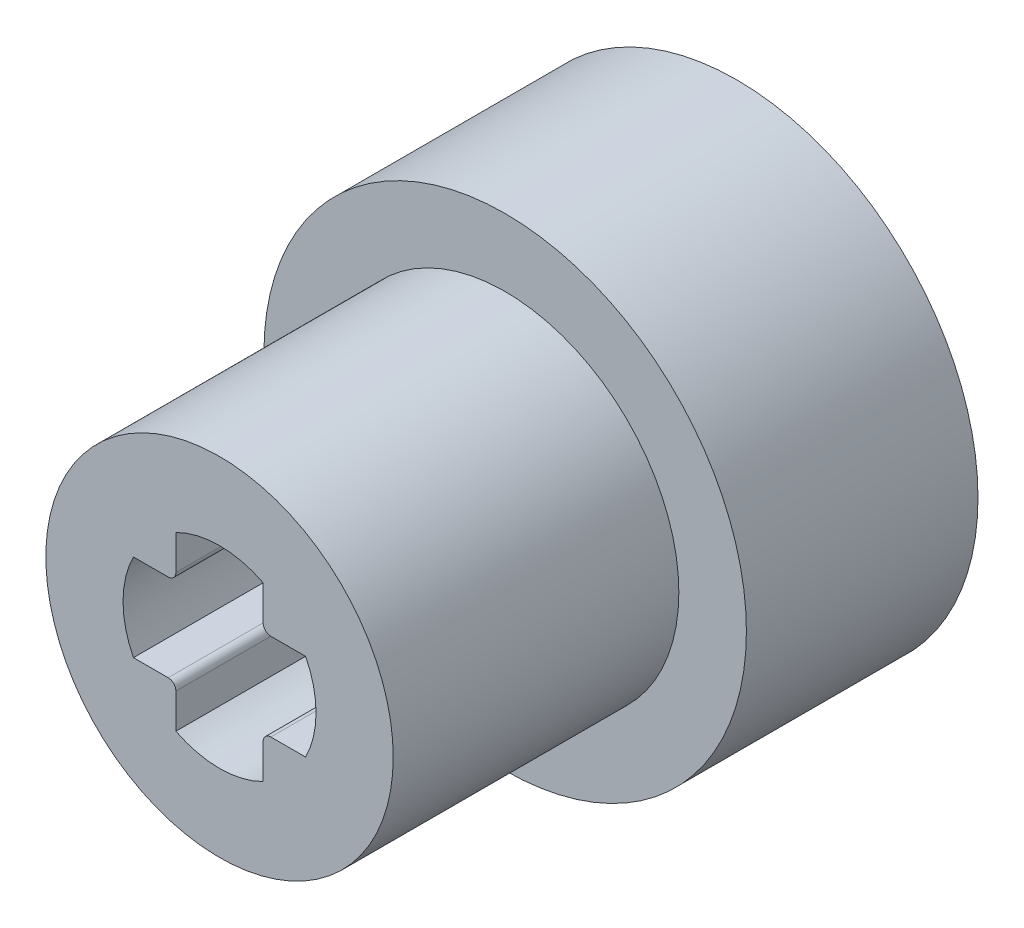
from build123d import *

# Parameters (mm, degrees)
SKETCH_1_R          = 6.25
SKETCH_1_R_2        = 1.25
EXTRUDE_1_DEPTH     = 5
EXTRUDE_START       = 5
SKETCH_1_5_R        = 6.25
EXTRUDE_2_DEPTH     = 1
SKETCH_2_R          = 4.5
EXTRUDE_3_DEPTH     = 7.4
CUT_EXTRUDE_START   = 7.4
CUT_EXTRUDE_1_DEPTH = 7.4
FILLET_1_R          = 0.2


with BuildPart() as part:
    # 草图1 → 凸台-拉伸1 (new body)
    with BuildSketch(Plane.XY):
        Circle(SKETCH_1_R)
        Circle(SKETCH_1_R_2, mode=Mode.SUBTRACT)
    extrude(amount=EXTRUDE_1_DEPTH)

    # 草图1<5> → 凸台-拉伸2 (add)
    with BuildSketch(Plane.XY.offset(EXTRUDE_START)):
        Circle(SKETCH_1_5_R)
    extrude(amount=EXTRUDE_2_DEPTH)

    # 草图2 → 凸台-拉伸3 (add)
    with BuildSketch(Plane.XY.offset(6)):
        Circle(SKETCH_2_R)
    extrude(amount=EXTRUDE_3_DEPTH)

    # 草图2<3> → 切除-拉伸1 (cut)
    with BuildSketch(Plane.XY.offset(6).offset(CUT_EXTRUDE_START)):
        with BuildLine():
            Line((-1.130029762, -1.130029762), (-1.130029762, -2.230029762))
            ThreePointArc((-1.130029762, -2.230029762), (0, -2.5), (1.130029762, -2.230029762))
            Line((1.130029762, -2.230029762), (1.130029762, -1.130029762))
            Line((1.130029762, -1.130029762), (2.230029762, -1.130029762))
            ThreePointArc((2.230029762, -1.130029762), (2.5, 0), (2.230029762, 1.130029762))
            Line((2.230029762, 1.130029762), (1.130029762, 1.130029762))
            Line((1.130029762, 1.130029762), (1.130029762, 2.230029762))
            ThreePointArc((1.130029762, 2.230029762), (0, 2.5), (-1.130029762, 2.230029762))
            Line((-1.130029762, 2.230029762), (-1.130029762, 1.130029762))
            Line((-1.130029762, 1.130029762), (-2.230029762, 1.130029762))
            ThreePointArc((-2.230029762, 1.130029762), (-2.5, 0), (-2.230029762, -1.130029762))
            Line((-2.230029762, -1.130029762), (-1.130029762, -1.130029762))
        make_face()
    extrude(amount=-CUT_EXTRUDE_1_DEPTH, mode=Mode.SUBTRACT)

    # 圆角1
    fillet_1_edges = [part.edges().sort_by_distance(p)[0] for p in [
        (-1.130029762, -1.130029762, 9.7),
        (-1.130029762, 1.130029762, 9.7),
        (1.130029762, 1.130029762, 9.7),
        (1.130029762, -1.130029762, 9.7),
    ]]
    fillet(fillet_1_edges, radius=FILLET_1_R)


solid = part.part
